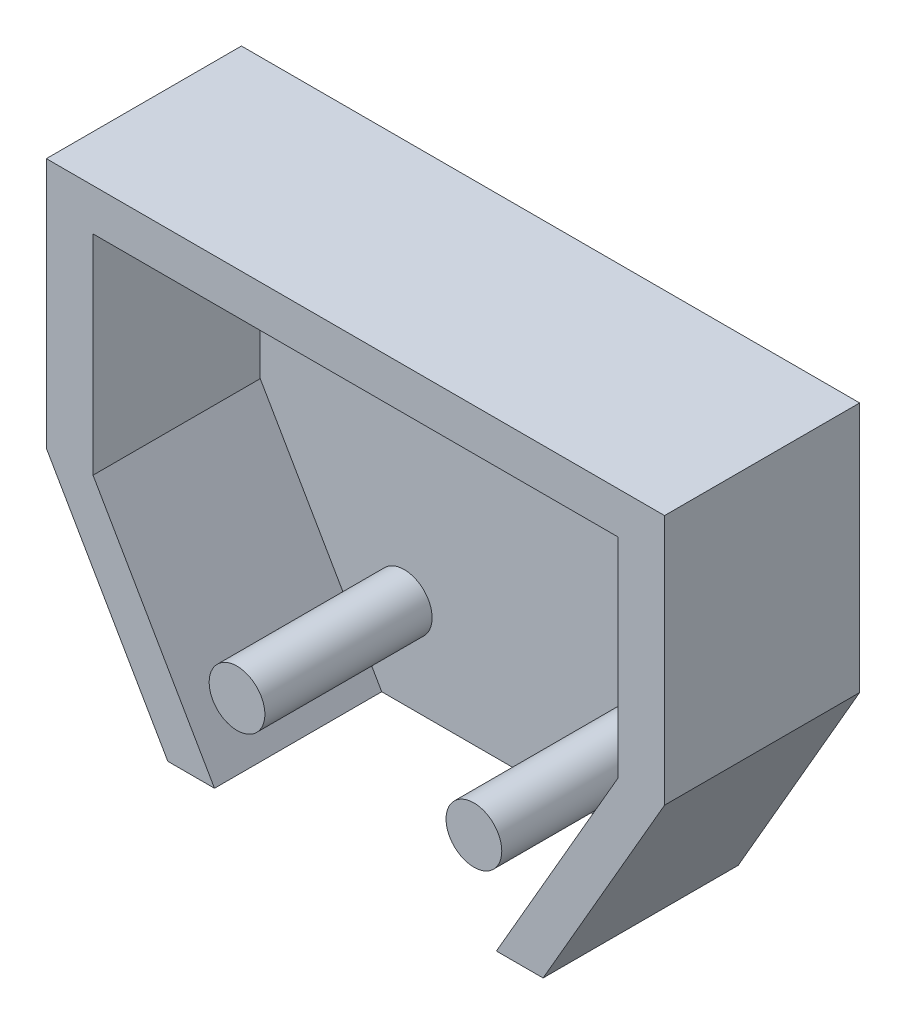
from build123d import *

# Parameters (mm, degrees)
EXTRUDE_1_DEPTH     = 2
EXTRUDE_5_DEPTH     = 12
SKETCH_3_R          = 2
EXTRUDE_6_DEPTH     = 12
CUT_EXTRUDE_1_DEPTH = 12
EXTRUDE_7_DEPTH     = 15
SKETCH_7_W          = 44.36597813
SKETCH_7_H          = 14
EXTRUDE_8_DEPTH     = 3
SKETCH_9_W          = 18.66
SKETCH_9_H          = 10
CUT_EXTRUDE_3_DEPTH = 1


with BuildPart() as part:
    # 스케치2 → 보스-돌출1 (new body)
    with BuildSketch(Plane.XY):
        Polygon((0, 0), (47.71, 0), (37.32, -17.996007891), (10.39, -17.996007891), align=None)
    extrude(amount=EXTRUDE_1_DEPTH)

    # 스케치4 → 보스-돌출5 (add)
    with BuildSketch(Plane.XY.offset(2)):
        Polygon((13.739529946, -17.996007891), (5.021540881, -2.896007891), (1.672010935, -2.896007891), (10.39, -17.996007891), align=None)
        Polygon((46.037989065, -2.896007891), (42.688459119, -2.896007891), (33.970470054, -17.996007891), (37.32, -17.996007891), align=None)
    extrude(amount=EXTRUDE_5_DEPTH)

    # 스케치3 → 보스-돌출6 (add)
    with BuildSketch(Plane.XY.offset(2)):
        with Locations(Location((15.355, -11.594084102, 0), (0, 0, 180))):
            Circle(SKETCH_3_R)
        with Locations((32.355, -11.594084102)):
            Circle(SKETCH_3_R)
    extrude(amount=EXTRUDE_6_DEPTH)

    # 스케치5 → 컷-돌출1 (cut)
    with BuildSketch(Plane.XY.offset(2)):
        Polygon((0, 0), (47.71, 0), (46.037989065, -2.896007891), (1.672010935, -2.896007891), align=None)
    extrude(amount=-CUT_EXTRUDE_1_DEPTH, mode=Mode.SUBTRACT)

    # 스케치6 → 보스-돌출7 (add)
    with BuildSketch(Plane(origin=(0, -2.896007891, 0), x_dir=(1, 0, 0), z_dir=(0, 1, 0))):
        Polygon((5.021540881, -14), (1.672010935, -14), (1.672010935, 0), (46.037989065, 0), (46.037989065, -14), (42.688459119, -14), (42.688459119, -2), (5.021540881, -2), align=None)
    extrude(amount=EXTRUDE_7_DEPTH)

    # 스케치7 → 보스-돌출8 (add)
    with BuildSketch(Plane(origin=(0, 12.103992109, 0), x_dir=(1, 0, 0), z_dir=(0, 1, 0))):
        with Locations((23.855, -7)):
            Rectangle(SKETCH_7_W, SKETCH_7_H)
    extrude(amount=EXTRUDE_8_DEPTH)

    # 스케치9 → 컷-돌출3 (cut)
    with BuildSketch(Plane.XZ.offset(-12.103992109)):
        with Locations((14.525, 8)):
            Rectangle(SKETCH_9_W, SKETCH_9_H)
        with Locations((33.185, 8)):
            Rectangle(SKETCH_9_W, SKETCH_9_H)
    extrude(amount=-CUT_EXTRUDE_3_DEPTH, mode=Mode.SUBTRACT)


solid = part.part
